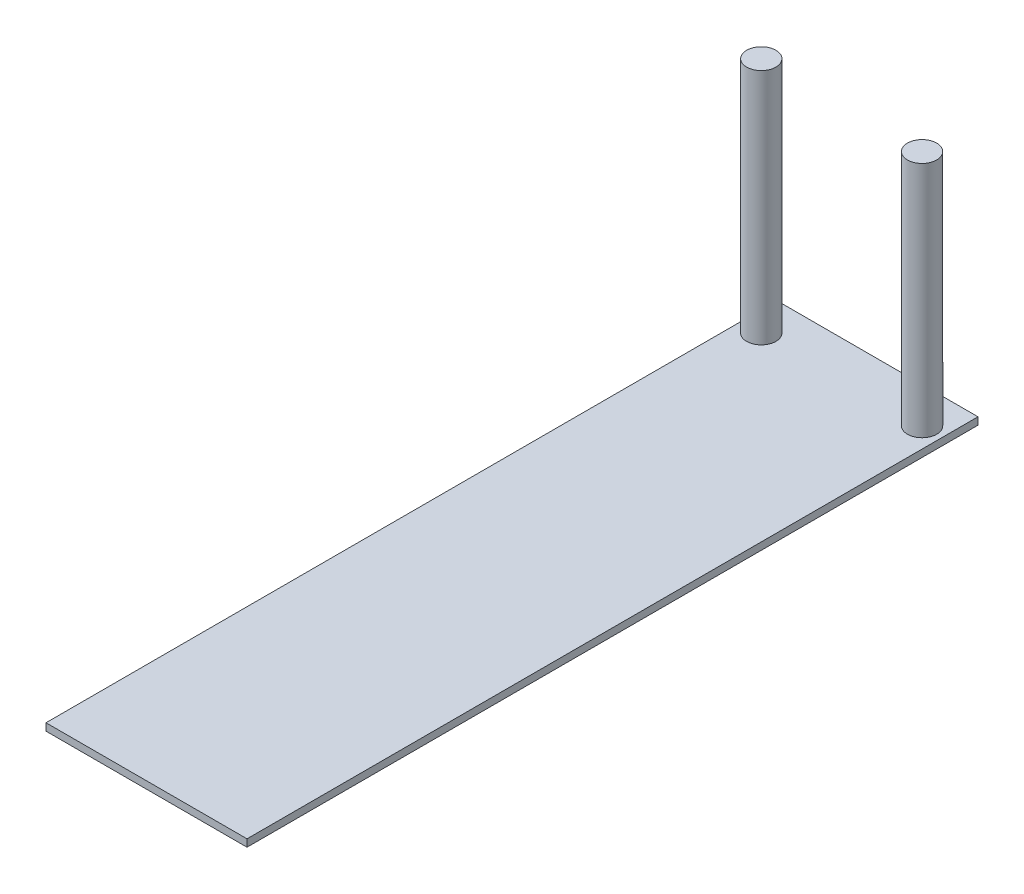
from build123d import *

# Parameters (mm, degrees)
SKETCH1_W           = 69.85
SKETCH1_H           = 254
BOSS_EXTRUDE1_DEPTH = 2.54
SKETCH2_R           = 5.08
BOSS_EXTRUDE2_DEPTH = 82.55


with BuildPart() as part:
    # Sketch1 → Boss-Extrude1 (new body)
    with BuildSketch(Plane(origin=(0, 0, 0), x_dir=(1, 0, 0), z_dir=(0, 1, 0))):
        with Locations((27.94, 0)):
            Rectangle(SKETCH1_W, SKETCH1_H)
    extrude(amount=BOSS_EXTRUDE1_DEPTH)

    # Sketch2 → Boss-Extrude2 (add)
    with BuildSketch(Plane(origin=(0, 2.54, 0), x_dir=(1, 0, 0), z_dir=(0, 1, 0))):
        with Locations(Location((0, 114.561094582, 0), (0, 0, 90))):
            Circle(SKETCH2_R)
        with Locations(Location((55.88, 114.561094582, 0), (0, 0, 90))):
            Circle(SKETCH2_R)
    extrude(amount=BOSS_EXTRUDE2_DEPTH)


solid = part.part
